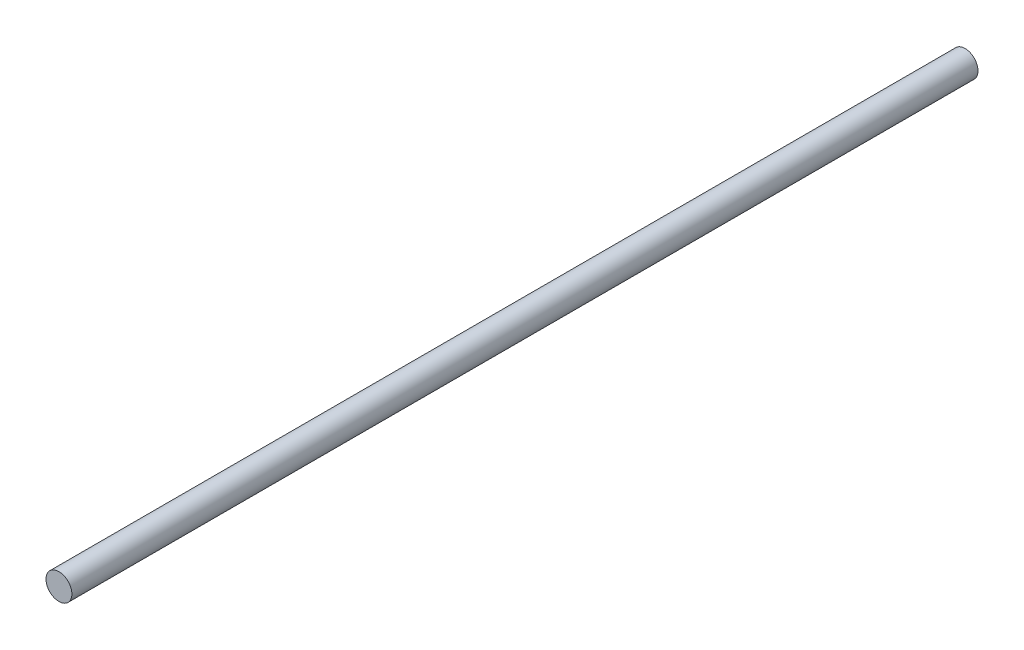
from build123d import *

# Parameters (mm, degrees)
ESQUISSE1_R        = 8
BOSS_EXTRU_1_DEPTH = 560


with BuildPart() as part:
    # Esquisse1 → Boss.-Extru.1 (new body)
    with BuildSketch(Plane.XY):
        Circle(ESQUISSE1_R)
    extrude(amount=BOSS_EXTRU_1_DEPTH)


solid = part.part
